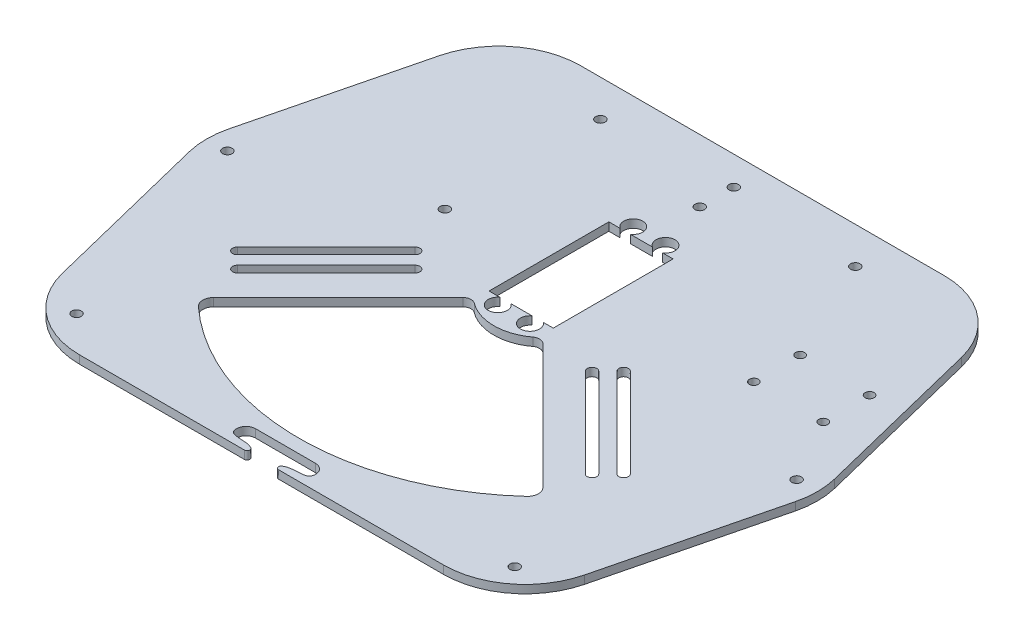
from build123d import *

# Parameters (mm, degrees)
EXTRUDE_1_DEPTH      = 3
SKETCH_2_R           = 1.75
CUT_EXTRUDE_1_DEPTH  = 10
CUT_EXTRUDE_2_DEPTH  = 10
CUT_EXTRUDE_3_DEPTH  = 10
SKETCH_5_R           = 1.75
CUT_EXTRUDE_4_DEPTH  = 10
SKETCH_6_R           = 1.65
CUT_EXTRUDE_5_DEPTH  = 10
CUT_EXTRUDE_8_DEPTH  = 10
CUT_EXTRUDE_9_DEPTH  = 10
CUT_EXTRUDE_10_DEPTH = 10


with BuildPart() as part:
    # 草图1 → 凸台-拉伸1 (new body)
    with BuildSketch(Plane(origin=(0, 0, 0), x_dir=(1, 0, 0), z_dir=(0, 1, 0))):
        with BuildLine():
            Line((-66.78059141, 154.593992167), (66.78059141, 154.593992167))
            ThreePointArc((66.78059141, 154.593992167), (85.265515034, 148.222525736), (95.898700635, 131.814498742))
            Line((95.898700635, 131.814498742), (111.265547961, 69.844672358))
            ThreePointArc((111.265547961, 69.844672358), (112.147438737, 62.624165782), (111.265547961, 55.403659207))
            Line((111.265547961, 55.403659207), (95.898700635, -6.566167178))
            ThreePointArc((95.898700635, -6.566167178), (85.265515034, -22.974194171), (66.78059141, -29.345660602))
            Line((66.78059141, -29.345660602), (-66.78059141, -29.345660602))
            ThreePointArc((-66.78059141, -29.345660602), (-85.265515034, -22.974194171), (-95.898700635, -6.566167178))
            Line((-95.898700635, -6.566167178), (-111.265547961, 55.403659207))
            ThreePointArc((-111.265547961, 55.403659207), (-112.147438737, 62.624165782), (-111.265547961, 69.844672358))
            Line((-111.265547961, 69.844672358), (-95.898700635, 131.814498742))
            ThreePointArc((-95.898700635, 131.814498742), (-85.265515034, 148.222525736), (-66.78059141, 154.593992167))
        make_face()
    extrude(amount=EXTRUDE_1_DEPTH)

    # 草图2 → 切除-拉伸1 (cut)
    with BuildSketch(Plane(origin=(0, 3, 0), x_dir=(1, 0, 0), z_dir=(0, 1, 0))):
        with Locations(Location((104.507530951, 62.624165782, 0), (0, 0, 270))):
            Circle(SKETCH_2_R)
        with Locations(Location((80.450184708, -16.818951307, 0), (0, 0, 270))):
            Circle(SKETCH_2_R)
        with Locations(Location((-80.450184708, -16.818951307, 0), (0, 0, 270))):
            Circle(SKETCH_2_R)
        with Locations(Location((-104.507530951, 62.624165782, 0), (0, 0, 270))):
            Circle(SKETCH_2_R)
        with Locations(Location((0, 144.079729864, 0), (0, 0, 270))):
            Circle(SKETCH_2_R)
        with Locations(Location((0, 131.568155221, 0), (0, 0, 270))):
            Circle(SKETCH_2_R)
    extrude(amount=-CUT_EXTRUDE_1_DEPTH, mode=Mode.SUBTRACT)

    # 草图3 → 切除-拉伸2 (cut)
    with BuildSketch(Plane(origin=(0, 3, 0), x_dir=(1, 0, 0), z_dir=(0, 1, 0))):
        with BuildLine():
            Line((14.696938457, 59.265841846), (44.774939174, 29.187841128))
            ThreePointArc((44.774939174, 29.187841128), (45.652778395, 26.995514412), (44.672172354, 24.847187174))
            ThreePointArc((44.672172354, 24.847187174), (0, 7.570427798), (-44.672172354, 24.847187174))
            ThreePointArc((-44.672172354, 24.847187174), (-45.652778395, 26.995514412), (-44.774939174, 29.187841128))
            Line((-44.774939174, 29.187841128), (-14.696938457, 59.265841846))
            ThreePointArc((-14.696938457, 59.265841846), (-12.790455415, 60.136819103), (-10.77910124, 59.547129902))
            ThreePointArc((-10.77910124, 59.547129902), (0, 55.962780302), (10.77910124, 59.547129902))
            ThreePointArc((10.77910124, 59.547129902), (12.790455415, 60.136819103), (14.696938457, 59.265841846))
        make_face()
    extrude(amount=-CUT_EXTRUDE_2_DEPTH, mode=Mode.SUBTRACT)

    # 草图4 → 切除-拉伸3 (cut)
    with BuildSketch(Plane(origin=(0, 3, 0), x_dir=(1, 0, 0), z_dir=(0, 1, 0))):
        with BuildLine():
            Line((-36.857879598, 37.104900704), (-60.429301447, 13.533478855))
            ThreePointArc((-60.429301447, 13.533478855), (-61.599780589, 10.611517412), (-60.293966994, 7.747476395))
            ThreePointArc((-60.293966994, 7.747476395), (0, -15.59071727), (60.293966994, 7.747476395))
            ThreePointArc((60.293966994, 7.747476395), (61.599780589, 10.611517412), (60.429301447, 13.533478855))
            Line((60.429301447, 13.533478855), (36.857879598, 37.104900704))
            Line((36.857879598, 37.104900704), (-36.857879598, 37.104900704))
        make_face()
    extrude(amount=-CUT_EXTRUDE_3_DEPTH, mode=Mode.SUBTRACT)

    # 草图5 → 切除-拉伸4 (cut)
    with BuildSketch(Plane(origin=(0, 3, 0), x_dir=(1, 0, 0), z_dir=(0, 1, 0))):
        with Locations(Location((47.527679448, 141.148627896, 0), (0, 0, 270))):
            Circle(SKETCH_5_R)
        with Locations(Location((-46.069524323, 84.050974576, 0), (0, 0, 270))):
            Circle(SKETCH_5_R)
        with Locations(Location((-46.069524323, 141.148627896, 0), (0, 0, 270))):
            Circle(SKETCH_5_R)
    extrude(amount=-CUT_EXTRUDE_4_DEPTH, mode=Mode.SUBTRACT)

    # 草图6 → 切除-拉伸5 (cut)
    with BuildSketch(Plane(origin=(0, 3, 0), x_dir=(1, 0, 0), z_dir=(0, 1, 0))):
        with Locations(Location((65.550657258, 102.864758009, 0), (0, 0, 270))):
            Circle(SKETCH_6_R)
        with Locations(Location((91.050657258, 102.864758009, 0), (0, 0, 270))):
            Circle(SKETCH_6_R)
        with Locations(Location((91.050657258, 85.864758009, 0), (0, 0, 270))):
            Circle(SKETCH_6_R)
        with Locations(Location((65.550657258, 85.864758009, 0), (0, 0, 270))):
            Circle(SKETCH_6_R)
    extrude(amount=-CUT_EXTRUDE_5_DEPTH, mode=Mode.SUBTRACT)

    # 草图7 → 切除-拉伸8 (cut)
    with BuildSketch(Plane(origin=(0, 3, 0), x_dir=(1, 0, 0), z_dir=(0, 1, 0))):
        with BuildLine():
            Line((-11.016648097, -20.513898252), (11.016648097, -20.513898252))
            ThreePointArc((11.016648097, -20.513898252), (13.814702514, -21.911306641), (14.378457093, -24.987674549))
            add(Edge.make_bspline(
                [(14.378457093, -24.987674549), (14.050661547, -26.11933694), (10.489346867, -26.76009099), (7.724749574, -26.493757466), (5.904508816, -27.417302496), (5.804576355, -27.473305111)],
                knots=[0, 0, 0, 0, 0.274123853, 0.745489655, 0.777393608, 0.777393608, 0.777393608, 0.777393608], degree=3))
            ThreePointArc((5.804576355, -27.473305111), (5.325885634, -28.59829127), (6.293448421, -29.345660602))
            Line((6.293448421, -29.345660602), (8.755585002, -29.345660602))
            Line((8.755585002, -29.345660602), (8.755585002, -31.412448424))
            Line((8.755585002, -31.412448424), (-8.755585002, -31.412448424))
            Line((-8.755585002, -31.412448424), (-8.755585002, -29.804465611))
            Line((-8.755585002, -29.804465611), (-8.755585002, -29.345660602))
            Line((-8.755585002, -29.345660602), (-6.293448421, -29.345660602))
            ThreePointArc((-6.293448421, -29.345660602), (-5.325885634, -28.59829127), (-5.804576355, -27.473305111))
            add(Edge.make_bspline(
                [(-14.378457093, -24.987674549), (-14.050661547, -26.11933694), (-10.489346867, -26.76009099), (-7.724749574, -26.493757466), (-5.904508816, -27.417302496), (-5.804576355, -27.473305111)],
                knots=[0, 0, 0, 0, 0.274123853, 0.745489655, 0.777393608, 0.777393608, 0.777393608, 0.777393608], degree=3))
            ThreePointArc((-14.378457093, -24.987674549), (-13.814702514, -21.911306641), (-11.016648097, -20.513898252))
        make_face()
    extrude(amount=-CUT_EXTRUDE_8_DEPTH, mode=Mode.SUBTRACT)

    # 草图8 → 切除-拉伸9 (cut)
    with BuildSketch(Plane(origin=(0, 3, 0), x_dir=(1, 0, 0), z_dir=(0, 1, 0))):
        with BuildLine():
            Line((-31.230806012, 58.302254227), (-63.873737866, 25.659322373))
            ThreePointArc((-63.873737866, 25.659322373), (-66.3486116, 25.659322373), (-66.3486116, 28.134196107))
            Line((-66.3486116, 28.134196107), (-33.705679746, 60.777127961))
            ThreePointArc((-33.705679746, 60.777127961), (-31.230806012, 60.777127961), (-31.230806012, 58.302254227))
        make_face()
        with BuildLine():
            Line((-37.026832233, 64.098280448), (-69.669764087, 31.455348594))
            ThreePointArc((-69.669764087, 31.455348594), (-72.144637821, 31.455348594), (-72.144637821, 33.930222328))
            Line((-72.144637821, 33.930222328), (-39.501705967, 66.573154182))
            ThreePointArc((-39.501705967, 66.573154182), (-37.026832233, 66.573154182), (-37.026832233, 64.098280448))
        make_face()
        with BuildLine():
            Line((37.026832233, 64.098280448), (69.669764087, 31.455348594))
            ThreePointArc((69.669764087, 31.455348594), (72.144637821, 31.455348594), (72.144637821, 33.930222328))
            Line((72.144637821, 33.930222328), (39.501705967, 66.573154182))
            ThreePointArc((39.501705967, 66.573154182), (37.026832233, 66.573154182), (37.026832233, 64.098280448))
        make_face()
        with BuildLine():
            Line((31.230806012, 58.302254227), (63.873737866, 25.659322373))
            ThreePointArc((63.873737866, 25.659322373), (66.3486116, 25.659322373), (66.3486116, 28.134196107))
            Line((66.3486116, 28.134196107), (33.705679746, 60.777127961))
            ThreePointArc((33.705679746, 60.777127961), (31.230806012, 60.777127961), (31.230806012, 58.302254227))
        make_face()
    extrude(amount=-CUT_EXTRUDE_9_DEPTH, mode=Mode.SUBTRACT)

    # 草图9 → 切除-拉伸10 (cut)
    with BuildSketch(Plane(origin=(0, 3, 0), x_dir=(1, 0, 0), z_dir=(0, 1, 0))):
        with BuildLine():
            Line((-3.845016723, 66.126250856), (3.845016723, 66.126250856))
            ThreePointArc((3.845016723, 66.126250856), (5.919206434, 59.807077742), (7.993396144, 66.126250856))
            Line((7.993396144, 66.126250856), (11.658238607, 66.126250856))
            Line((11.658238607, 66.126250856), (11.658238607, 110.119100398))
            Line((11.658238607, 110.119100398), (7.806916331, 110.119100398))
            ThreePointArc((7.806916331, 110.119100398), (5.919206434, 116.566395996), (4.031496536, 110.119100398))
            Line((4.031496536, 110.119100398), (-4.031496536, 110.119100398))
            ThreePointArc((-4.031496536, 110.119100398), (-5.919206434, 116.566395996), (-7.806916331, 110.119100398))
            Line((-7.806916331, 110.119100398), (-11.930882282, 110.119100398))
            Line((-11.930882282, 110.119100398), (-11.930882282, 66.126250856))
            Line((-11.930882282, 66.126250856), (-7.993396144, 66.126250856))
            ThreePointArc((-7.993396144, 66.126250856), (-5.919206434, 59.807077742), (-3.845016723, 66.126250856))
        make_face()
    extrude(amount=-CUT_EXTRUDE_10_DEPTH, mode=Mode.SUBTRACT)


solid = part.part
